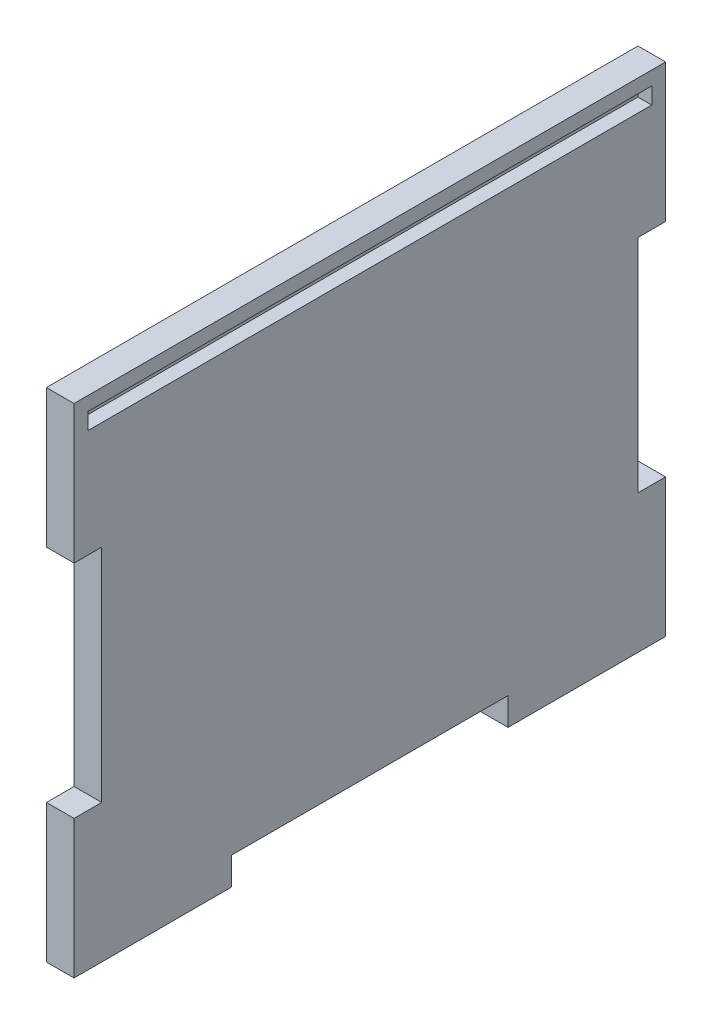
from build123d import *

# Parameters (mm, degrees)
SKETCH1_W           = 107
SKETCH1_H           = 90
BOSS_EXTRUDE1_DEPTH = 5
SKETCH5_W           = 5
SKETCH5_H           = 40
CUT_EXTRUDE2_DEPTH  = 140.907112042
SKETCH6_W           = 5
SKETCH6_H           = 40
CUT_EXTRUDE3_DEPTH  = 140.907112042
SKETCH7_W           = 50
SKETCH7_H           = 5
CUT_EXTRUDE4_DEPTH  = 140.907112042
SKETCH8_W           = 102
SKETCH8_H           = 3
CUT_EXTRUDE5_DEPTH  = 2.5


with BuildPart() as part:
    # Sketch1 → Boss-Extrude1 (new body)
    with BuildSketch(Plane(origin=(0, 0, 0), x_dir=(0, 0, -1), z_dir=(1, 0, 0))):
        with Locations((53.5, 45)):
            Rectangle(SKETCH1_W, SKETCH1_H)
    extrude(amount=BOSS_EXTRUDE1_DEPTH)

    # Sketch5 → Cut-Extrude2 (cut, through all)
    with BuildSketch(Plane(origin=(5, 0, 0), x_dir=(0, 0, -1), z_dir=(1, 0, 0))):
        with Locations((2.5, 45)):
            Rectangle(SKETCH5_W, SKETCH5_H)
    extrude(amount=-CUT_EXTRUDE2_DEPTH, mode=Mode.SUBTRACT)

    # Sketch6 → Cut-Extrude3 (cut, through all)
    with BuildSketch(Plane(origin=(5, 0, 0), x_dir=(0, 0, -1), z_dir=(1, 0, 0))):
        with Locations((104.5, 45)):
            Rectangle(SKETCH6_W, SKETCH6_H)
    extrude(amount=-CUT_EXTRUDE3_DEPTH, mode=Mode.SUBTRACT)

    # Sketch7 → Cut-Extrude4 (cut, through all)
    with BuildSketch(Plane(origin=(5, 0, 0), x_dir=(0, 0, -1), z_dir=(1, 0, 0))):
        with Locations((53.5, 2.5)):
            Rectangle(SKETCH7_W, SKETCH7_H)
    extrude(amount=-CUT_EXTRUDE4_DEPTH, mode=Mode.SUBTRACT)

    # Sketch8 → Cut-Extrude5 (cut)
    with BuildSketch(Plane(origin=(5, 0, 0), x_dir=(0, 0, -1), z_dir=(1, 0, 0))):
        with Locations((53.5, 86)):
            Rectangle(SKETCH8_W, SKETCH8_H)
    extrude(amount=-CUT_EXTRUDE5_DEPTH, mode=Mode.SUBTRACT)


solid = part.part
